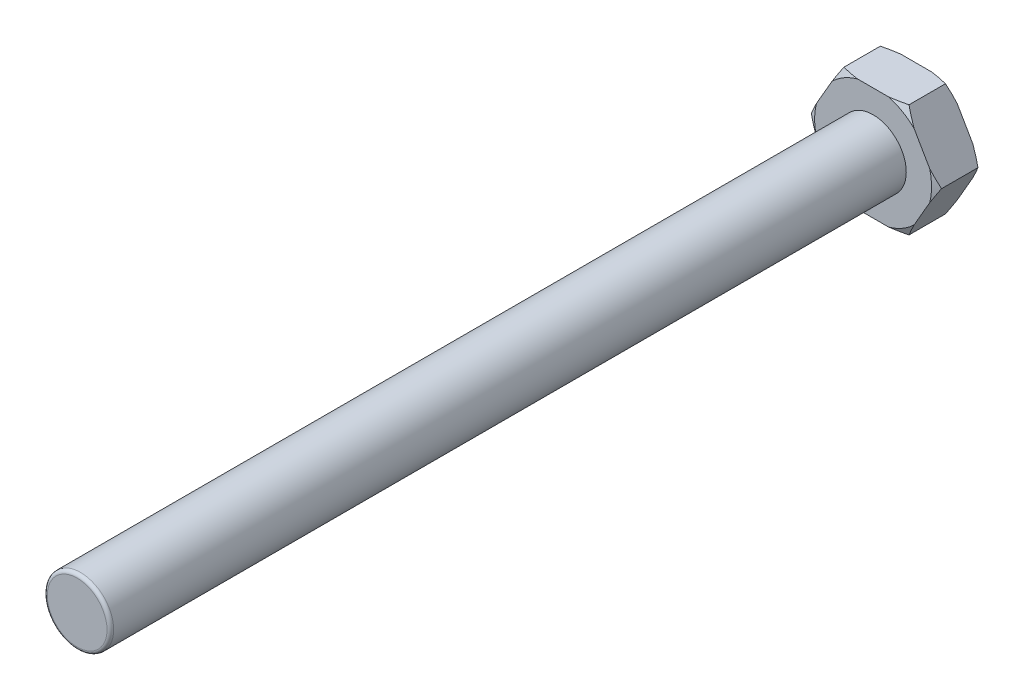
from build123d import *

# Parameters (mm, degrees)
Y_KSEKLIK_EKSTR_ZYON1_DEPTH = 6.5
IZIM2_R                     = 5
Y_KSEKLIK_EKSTR_ZYON2_DEPTH = 120
RADYUS1_R                   = 0.5


with BuildPart() as part:
    # Çizim1 → Yükseklik-Ekstrüzyon1 (new body)
    with BuildSketch(Plane.XY):
        Polygon((9.814954576, 0), (4.907477288, 8.5), (-4.907477288, 8.5), (-9.814954576, 0), (-4.907477288, -8.5), (4.907477288, -8.5), align=None)
    extrude(amount=Y_KSEKLIK_EKSTR_ZYON1_DEPTH)

    # Çizim2 → Yükseklik-Ekstrüzyon2 (add)
    with BuildSketch(Plane.XY.offset(6.5)):
        Circle(IZIM2_R)
    extrude(amount=Y_KSEKLIK_EKSTR_ZYON2_DEPTH)

    # Çizim3 → Kes-Döndür1 (revolve, cut)
    with BuildSketch(Plane(origin=(0, 0, 0), x_dir=(1, 0, 0), z_dir=(0, 1, 0))):
        Polygon((-9.814954576, 0), (-8.814954576, 0), (-9.814954576, -0.5), align=None)
        Polygon((-9.814954576, -6.5), (-9.814954576, -6), (-8.814954576, -6.5), align=None)
    revolve(axis=Axis((0, 0, 0), (0, 0, 1)), mode=Mode.SUBTRACT)

    # Radyus1
    radyus1_edges = [part.edges().sort_by_distance(p)[0] for p in [
        (-5, 0, 126.5),
    ]]
    fillet(radyus1_edges, radius=RADYUS1_R)


solid = part.part
